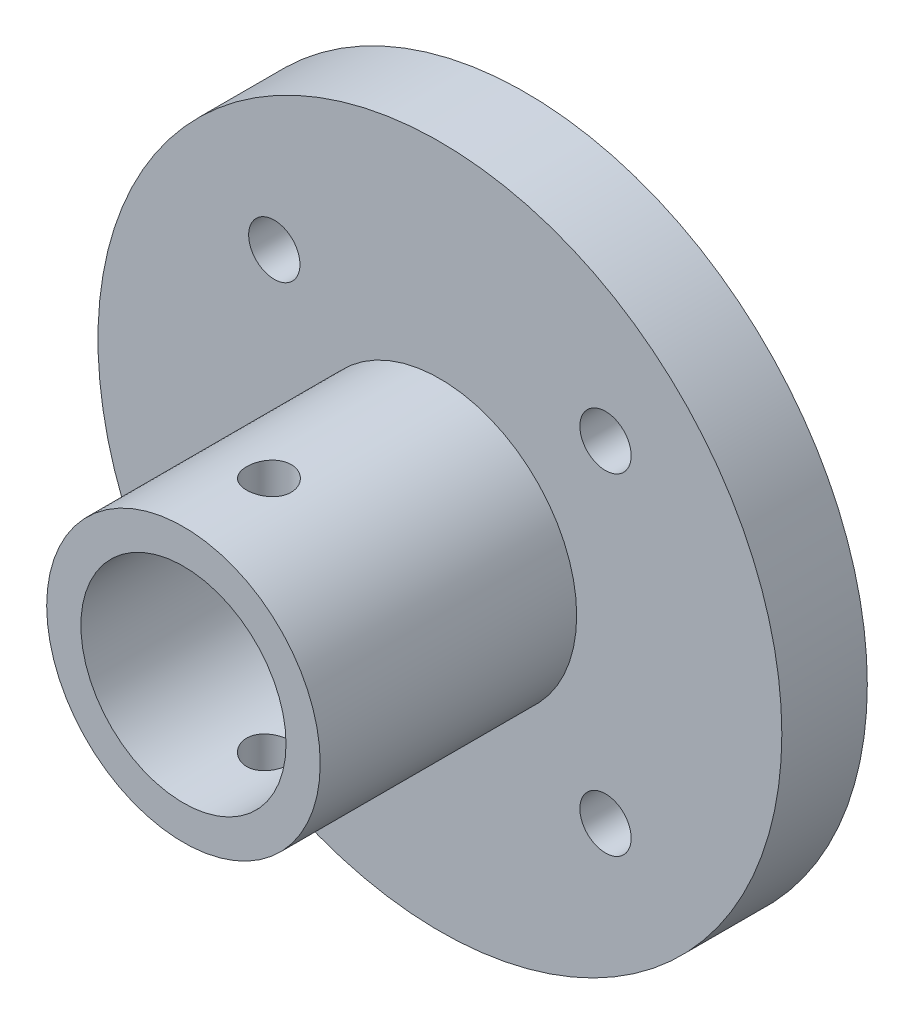
from build123d import *

# Parameters (mm, degrees)
SKETCH1_R               = 20
SKETCH1_R_2             = 6
SKETCH1_R_3             = 1.5
BOSS_EXTRUDE1_DEPTH     = 5
SKETCH2_R               = 8
SKETCH2_R_2             = 6
BOSS_EXTRUDE2_DEPTH     = 15
CUT_EXTRUDE1_DEPTH      = 35.641016151
CUT_EXTRUDE1_DEPTH_BACK = 35.641016151
SKETCH3_R               = 1.301925598


with BuildPart() as part:
    # Sketch1 → Boss-Extrude1 (new body)
    with BuildSketch(Plane.XY):
        Circle(SKETCH1_R)
        Circle(SKETCH1_R_2, mode=Mode.SUBTRACT)
        with Locations((-9.686203462, 9.686203462)):
            Circle(SKETCH1_R_3, mode=Mode.SUBTRACT)
        with Locations(Location((9.686203462, 9.686203462, 0), (0, 0, 180))):
            Circle(SKETCH1_R_3, mode=Mode.SUBTRACT)
        with Locations((9.686203462, -9.686203462)):
            Circle(SKETCH1_R_3, mode=Mode.SUBTRACT)
        with Locations(Location((-9.686203462, -9.686203462, 0), (0, 0, 180))):
            Circle(SKETCH1_R_3, mode=Mode.SUBTRACT)
    extrude(amount=BOSS_EXTRUDE1_DEPTH)

    # Sketch2 → Boss-Extrude2 (add)
    with BuildSketch(Plane.XY.offset(5)):
        Circle(SKETCH2_R)
        Circle(SKETCH2_R_2, mode=Mode.SUBTRACT)
    extrude(amount=BOSS_EXTRUDE2_DEPTH)

    # Sketch3 → Cut-Extrude1 (cut, two sides: drawn at the far end of the back side and taken through both)
    with BuildSketch(Plane(origin=(0, 0, 0), x_dir=(1, 0, 0), z_dir=(0, 1, 0)).offset(-CUT_EXTRUDE1_DEPTH_BACK)):
        with Locations(Location((0, -15, 0), (0, 0, 270))):
            Circle(SKETCH3_R)
    extrude(amount=CUT_EXTRUDE1_DEPTH + CUT_EXTRUDE1_DEPTH_BACK, mode=Mode.SUBTRACT)


solid = part.part
